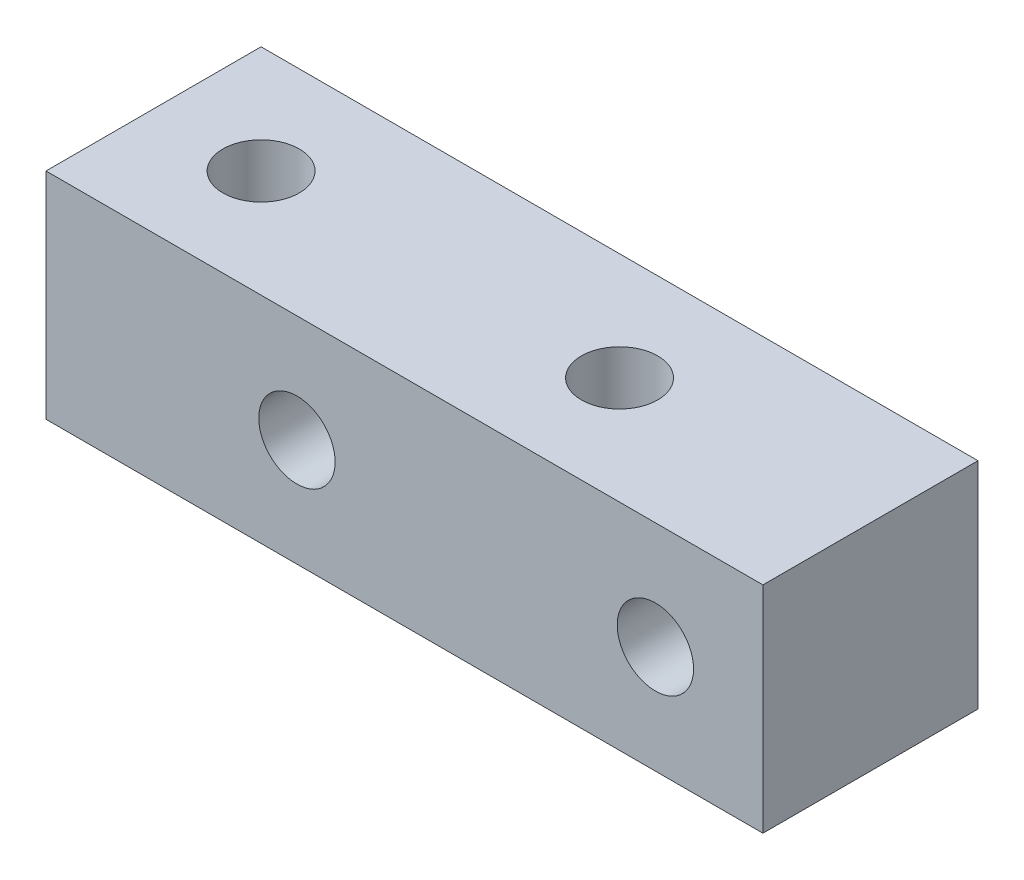
from build123d import *

# Parameters (mm, degrees)
SKETCH1_W                 = 25.4
SKETCH1_H                 = 7.62
BOSS_EXTRUDE1_DEPTH       = 3.81
TAP_DRILL_FOR_6_32_TAP1_D = 2.7051
TAP_DRILL_FOR_6_32_TAP2_D = 2.7051


with BuildPart() as part:
    # Sketch1 → Boss-Extrude1 (new, symmetric)
    with BuildSketch(Plane(origin=(0, 0, 0), x_dir=(1, 0, 0), z_dir=(0, 1, 0))):
        Rectangle(SKETCH1_W, SKETCH1_H)
    extrude(amount=BOSS_EXTRUDE1_DEPTH, both=True)

    # Tap Drill for #6-32 Tap1 (through all)
    with Locations(Plane(origin=(0, 3.81, 0), x_dir=(1, 0, 0), z_dir=(0, 1, 0))):
        with Locations((-8.89, 0), (3.81, 0)):
            Hole(TAP_DRILL_FOR_6_32_TAP1_D / 2)

    # Tap Drill for #6-32 Tap2 (through all)
    with Locations(Plane.XY.offset(3.81)):
        with Locations((-3.81, 0), (8.89, 0)):
            Hole(TAP_DRILL_FOR_6_32_TAP2_D / 2)


solid = part.part
